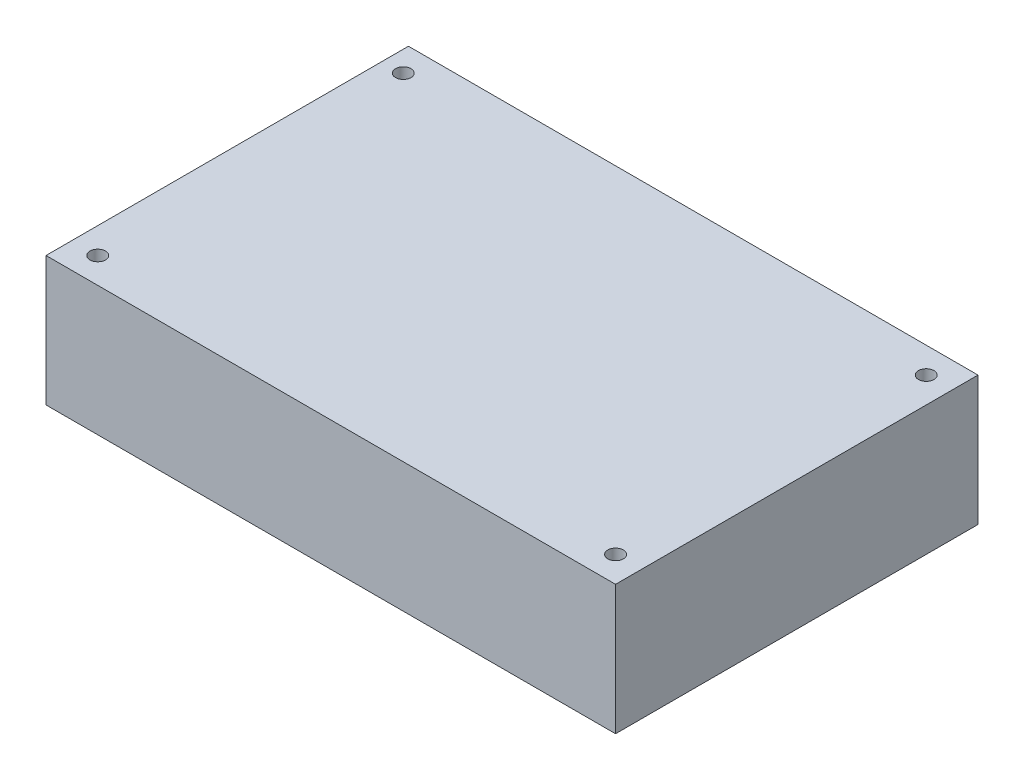
from build123d import *

# Parameters (mm, degrees)
SKETCH1_W           = 110
SKETCH1_H           = 70
SKETCH1_R           = 1.5
BOSS_EXTRUDE1_DEPTH = 25


with BuildPart() as part:
    # Sketch1 → Boss-Extrude1 (new body)
    with BuildSketch(Plane(origin=(0, 0, 0), x_dir=(1, 0, 0), z_dir=(0, 1, 0))):
        Rectangle(SKETCH1_W, SKETCH1_H)
        with Locations(Location((-51, 30, 0), (0, 0, 270))):
            Circle(SKETCH1_R, mode=Mode.SUBTRACT)
        with Locations(Location((50, 30, 0), (0, 0, 270))):
            Circle(SKETCH1_R, mode=Mode.SUBTRACT)
        with Locations(Location((50, -30, 0), (0, 0, 270))):
            Circle(SKETCH1_R, mode=Mode.SUBTRACT)
        with Locations(Location((-50, -30, 0), (0, 0, 270))):
            Circle(SKETCH1_R, mode=Mode.SUBTRACT)
    extrude(amount=BOSS_EXTRUDE1_DEPTH)


solid = part.part
